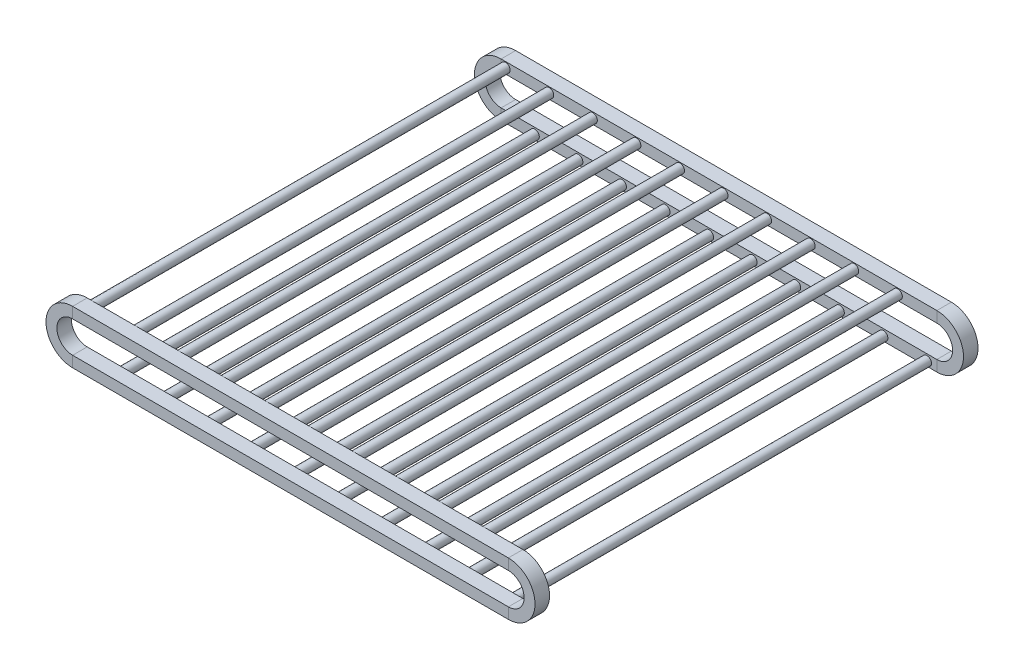
from build123d import *

# Parameters (mm, degrees)
SKETCH3_W           = 40
SKETCH3_H           = 30
SKETCH4_R           = 12.5
BOSS_EXTRUDE1_DEPTH = 1180
LPATTERN1_COUNT     = 10
LPATTERN1_PITCH     = 120
LPATTERN2_COUNT     = 2
LPATTERN2_PITCH     = 1180
SKETCH5_R           = 12.5
BOSS_EXTRUDE2_DEPTH = 1170
LPATTERN3_COUNT     = 10
LPATTERN3_PITCH     = 120


with BuildPart() as part:
    # Sweep1: sweep along a path in Sketch2
    with BuildLine(Plane.XY) as sweep1_path:
        Line((0, 50), (1200, 50))
        ThreePointArc((1200, 50), (1250, 0), (1200, -50))
        Line((1200, -50), (0, -50))
        ThreePointArc((0, -50), (-50, 0), (0, 50))
    # Sketch3 → Sweep1 (sweep)
    with BuildSketch(Plane(origin=(0, 0, 0), x_dir=(0, 0, -1), z_dir=(1, 0, 0))):
        with Locations((0, 58.363712196)):
            Rectangle(SKETCH3_W, SKETCH3_H)
    sweep1 = sweep(path=sweep1_path.line)

    # Sketch4 → Boss-Extrude1 (add)
    with BuildSketch(Plane(origin=(0, 0, -20), x_dir=(-1, 0, 0), z_dir=(0, 0, -1))):
        with Locations(Location((-1092.450954457, 58.961219157, 0), (0, 0, 270))):
            Circle(SKETCH4_R)
    boss_extrude1 = extrude(amount=BOSS_EXTRUDE1_DEPTH)

    # LPattern1: Boss-Extrude1 ×10
    with Locations(*[(-i * LPATTERN1_PITCH, 0, 0) for i in range(1, LPATTERN1_COUNT)]):
        add(boss_extrude1)

    # LPattern2: Sweep1 ×2
    with Locations(*[(0, 0, -i * LPATTERN2_PITCH) for i in range(1, LPATTERN2_COUNT)]):
        add(sweep1)

    # Sketch5 → Boss-Extrude2 (add)
    with BuildSketch(Plane(origin=(0, 0, -20), x_dir=(-1, 0, 0), z_dir=(0, 0, -1))):
        with Locations(Location((-1172.681087279, -60.134950417, 0), (0, 0, 270))):
            Circle(SKETCH5_R)
    boss_extrude2 = extrude(amount=BOSS_EXTRUDE2_DEPTH)

    # LPattern3: Boss-Extrude2 ×10
    with Locations(*[(-i * LPATTERN3_PITCH, 0, 0) for i in range(1, LPATTERN3_COUNT)]):
        add(boss_extrude2)


solid = part.part
